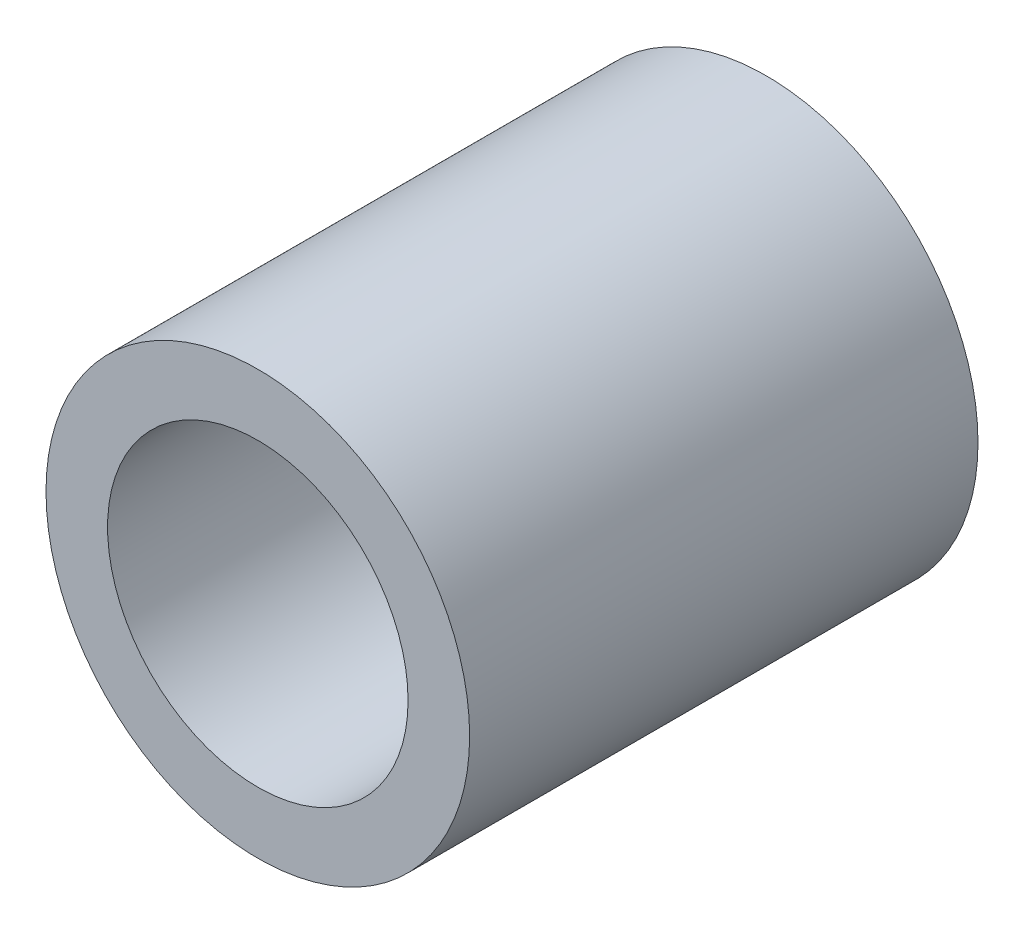
from build123d import *

# Parameters (mm, degrees)
SKETCH1_R           = 4.7625
SKETCH1_R_2         = 3.3782
BOSS_EXTRUDE1_DEPTH = 11.43


with BuildPart() as part:
    # Sketch1 → Boss-Extrude1 (new body)
    with BuildSketch(Plane.XY):
        Circle(SKETCH1_R)
        Circle(SKETCH1_R_2, mode=Mode.SUBTRACT)
    extrude(amount=BOSS_EXTRUDE1_DEPTH)


solid = part.part
